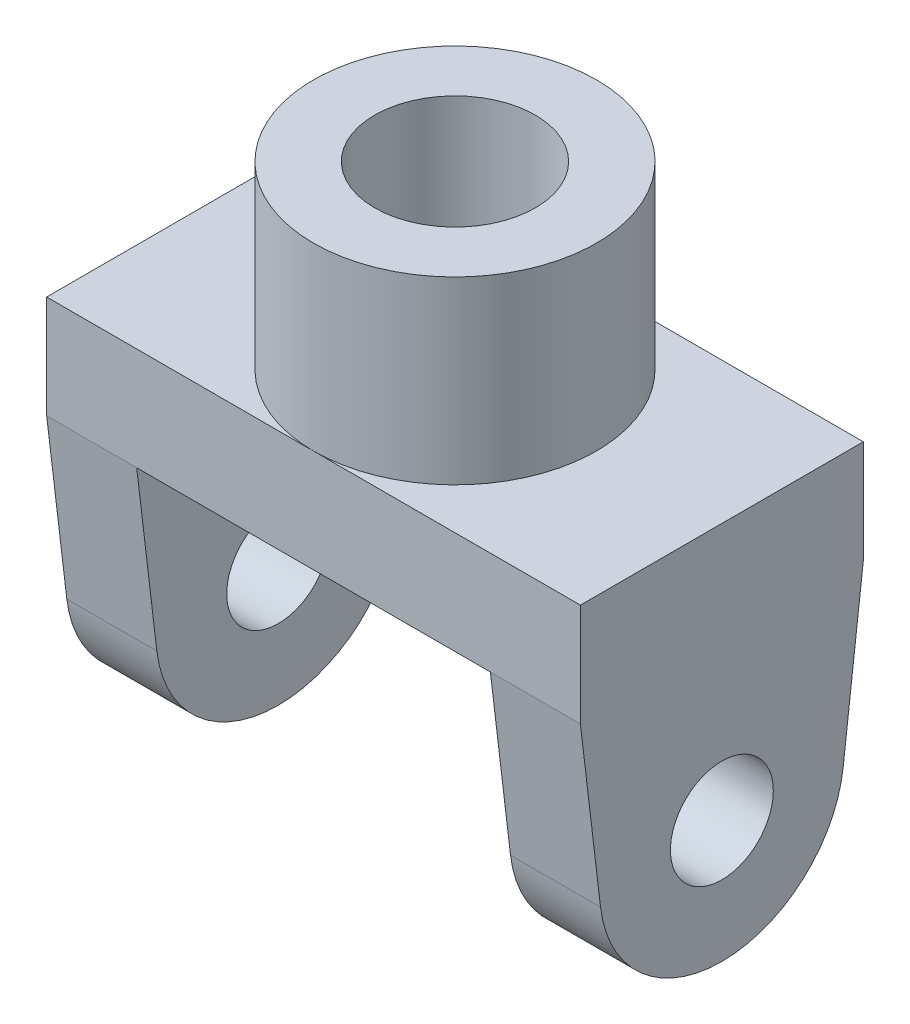
from build123d import *

# Parameters (mm, degrees)
SKETCH1_W           = 166
SKETCH1_H           = 88
BOSS_EXTRUDE1_DEPTH = 32
SKETCH2_R           = 44
SKETCH2_R_2         = 25
BOSS_EXTRUDE2_DEPTH = 56
SKETCH3_R           = 16
BOSS_EXTRUDE3_DEPTH = 28


with BuildPart() as part:
    # Sketch1 → Boss-Extrude1 (new body)
    with BuildSketch(Plane(origin=(0, 0, 0), x_dir=(1, 0, 0), z_dir=(0, 1, 0))):
        Rectangle(SKETCH1_W, SKETCH1_H)
    extrude(amount=BOSS_EXTRUDE1_DEPTH)

    # Sketch2 → Boss-Extrude2 (add)
    with BuildSketch(Plane(origin=(0, 32, 0), x_dir=(1, 0, 0), z_dir=(0, 1, 0))):
        with Locations(Location((0, 0, 0), (0, 0, 270))):
            Circle(SKETCH2_R)
        with Locations(Location((0, 0, 0), (0, 0, 270))):
            Circle(SKETCH2_R_2, mode=Mode.SUBTRACT)
    extrude(amount=BOSS_EXTRUDE2_DEPTH)

    # Sketch3 → Boss-Extrude3 (add)
    with BuildSketch(Plane(origin=(83, 0, 0), x_dir=(0, 0, -1), z_dir=(1, 0, 0))):
        with BuildLine():
            Line((-37.732085488, -52.504411697), (-44, 0))
            Line((-44, 0), (44, 0))
            Line((44, 0), (37.732085488, -52.504411697))
            ThreePointArc((37.732085488, -52.504411697), (0, -86), (-37.732085488, -52.504411697))
        make_face()
        with Locations((0, -48)):
            Circle(SKETCH3_R, mode=Mode.SUBTRACT)
    boss_extrude3 = extrude(amount=-BOSS_EXTRUDE3_DEPTH)

    # Mirror1: Boss-Extrude3 across plane
    add(boss_extrude3.mirror(Plane(origin=(0, 0, 0), x_dir=(0, 0, 1), z_dir=(1, 0, 0))))


solid = part.part
